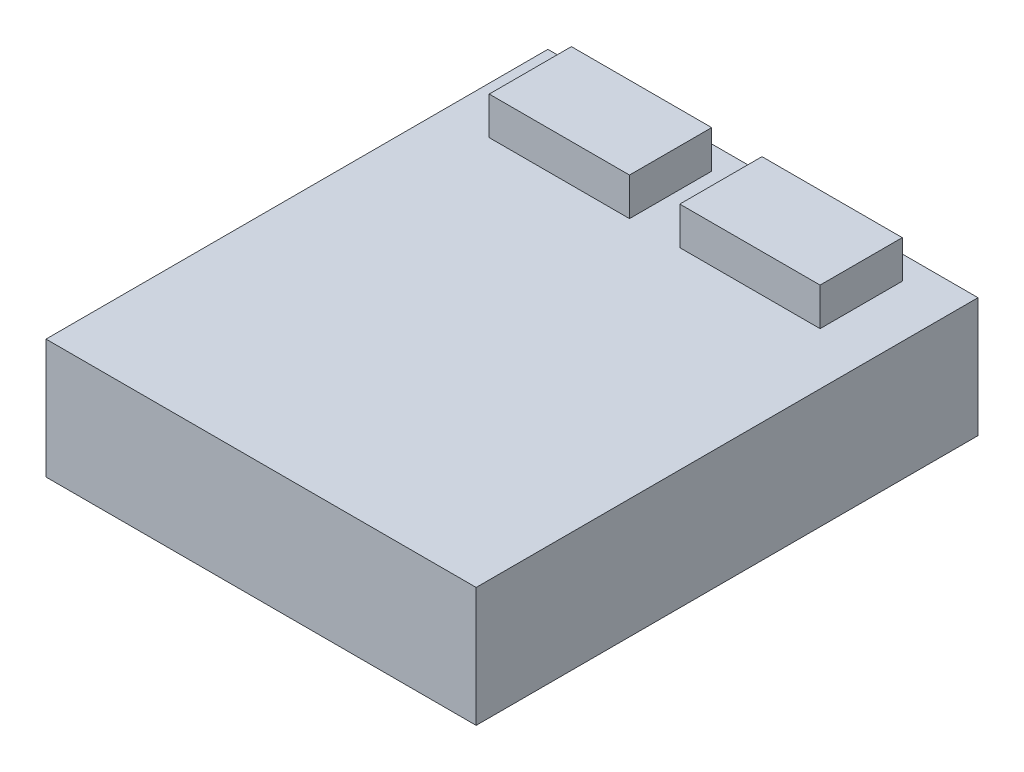
from build123d import *

# Parameters (mm, degrees)
SKETCH_1_W      = 1800
SKETCH_1_H      = 2100
EXTRUDE_1_DEPTH = 250
SKETCH_2_W      = 586.997926232
SKETCH_2_H      = 343.897774964
EXTRUDE_2_DEPTH = 158


with BuildPart() as part:
    # Эскиз1 → Бобышка-Вытянуть1 (new, symmetric)
    with BuildSketch(Plane(origin=(0, 0, 0), x_dir=(1, 0, 0), z_dir=(0, 1, 0))):
        with Locations((900, 1050)):
            Rectangle(SKETCH_1_W, SKETCH_1_H)
    extrude(amount=EXTRUDE_1_DEPTH, both=True)

    # Эскиз2 → Бобышка-Вытянуть2 (add)
    with BuildSketch(Plane(origin=(0, 250, 0), x_dir=(1, 0, 0), z_dir=(0, 1, 0))):
        with Locations((490.880233232, 1829.277683609)):
            Rectangle(SKETCH_2_W, SKETCH_2_H)
        with Locations((1288.36731483, 1829.277683609)):
            Rectangle(SKETCH_2_W, SKETCH_2_H)
    extrude(amount=EXTRUDE_2_DEPTH)


solid = part.part
